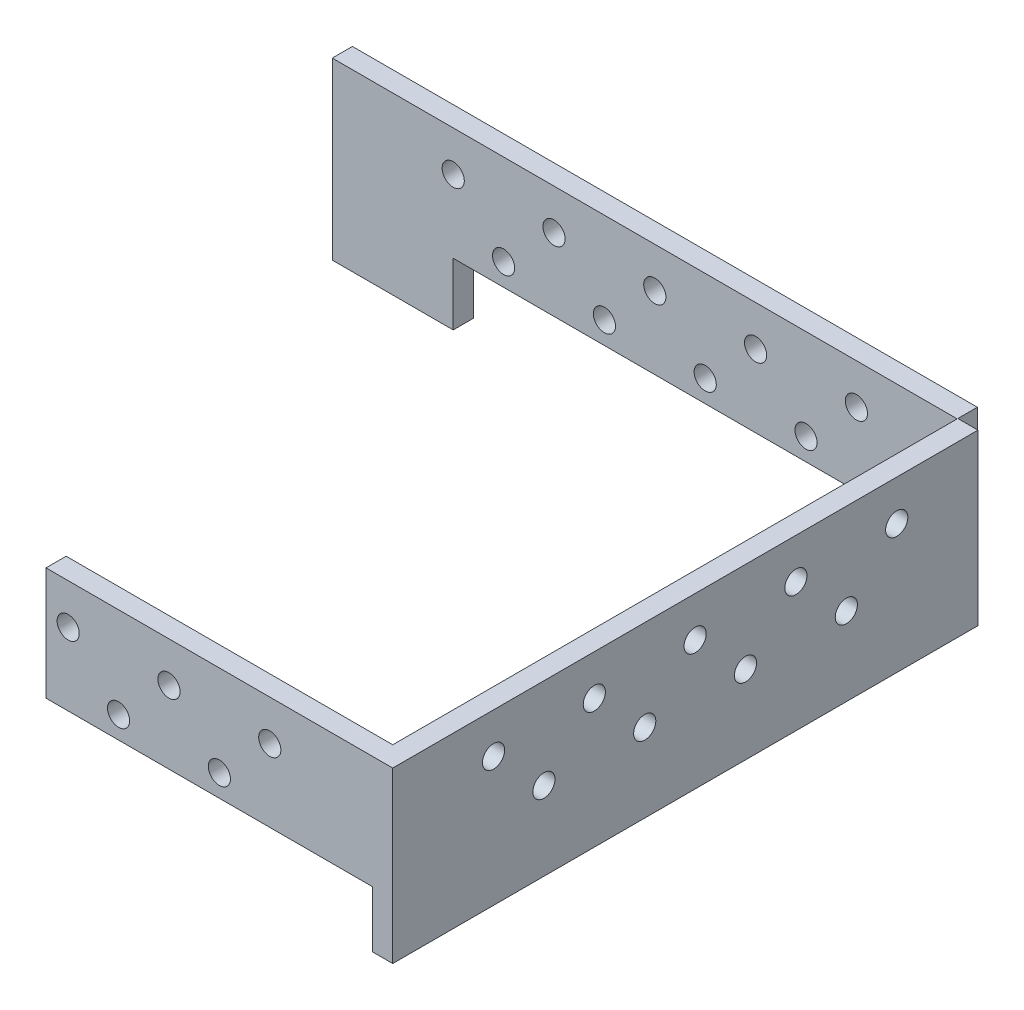
from build123d import *

# Parameters (mm, degrees)
SKETCH1_W                      = 42
SKETCH1_H                      = 145.161285219
BOSS_EXTRUDE1_DEPTH            = 5
BOSS_EXTRUDE2_DEPTH            = 5
SKETCH3_W                      = 5
SKETCH3_H                      = 27.999999523
BOSS_EXTRUDE3_DEPTH            = 81.000003815
F_5_5_5_5_DIAMETER_HOLE1_D     = 5.5
F_5_5_5_5_DIAMETER_HOLE2_D     = 5.5
F_5_5_5_5_DIAMETER_HOLE2_DEPTH = 5
F_5_5_5_5_DIAMETER_HOLE3_D     = 5.5
F_5_5_5_5_DIAMETER_HOLE3_DEPTH = 5


with BuildPart() as part:
    # Sketch1 → Boss-Extrude1 (new body)
    with BuildSketch(Plane(origin=(-5, 0, 0), x_dir=(0, -1, 0), z_dir=(-1, 0, 0))):
        with Locations((21, -72.58064261)):
            Rectangle(SKETCH1_W, SKETCH1_H)
    extrude(amount=-BOSS_EXTRUDE1_DEPTH)

    # Sketch2 → Boss-Extrude2 (add)
    with BuildSketch(Plane(origin=(0, 0, -150), x_dir=(-1, 0, 0), z_dir=(0, 0, -1))):
        Polygon((130, -43.400001526), (160, -43.400001526), (160, 0), (5, 0), (5, -27.999999523), (130, -27.999999523), align=None)
    extrude(amount=-BOSS_EXTRUDE2_DEPTH)

    # Sketch3 → Boss-Extrude3 (add)
    with BuildSketch(Plane.ZY.offset(5)):
        with Locations((-2.5, -13.999999762)):
            Rectangle(SKETCH3_W, SKETCH3_H)
    extrude(amount=BOSS_EXTRUDE3_DEPTH)

    # Ø5.5 (5.5) Diameter Hole1 (through all)
    with Locations(Plane.ZY.offset(5)):
        with Locations((-37.500000596, -22.500000199), (-25.000000199, -9.99999995), (-50.000000795, -9.99999995), (-62.500000795, -22.500000199), (-75.000000795, -9.99999995), (-87.500000795, -22.500000199), (-112.500000795, -22.500000199), (-100.000000795, -9.99999995), (-125.000000795, -9.99999995)):
            Hole(F_5_5_5_5_DIAMETER_HOLE1_D / 2)

    # Ø5.5 (5.5) Diameter Hole2
    with Locations(Plane.XY.offset(-145)):
        with Locations((-30.000000199, -9.99999995), (-42.500000397, -22.500000199), (-67.500000795, -22.500000199), (-55.000000795, -9.99999995), (-80.000001192, -9.99999995), (-92.500000795, -22.500000199), (-117.500000795, -22.500000199), (-105.000000795, -9.99999995), (-130.000003179, -9.99999995)):
            Hole(F_5_5_5_5_DIAMETER_HOLE2_D / 2, depth=F_5_5_5_5_DIAMETER_HOLE2_DEPTH)

    # Ø5.5 (5.5) Diameter Hole3
    with Locations(Plane(origin=(0, 0, -5), x_dir=(-1, 0, 0), z_dir=(0, 0, -1))):
        with Locations((80.50000151, -9.99999995), (68.000001113, -22.500000199), (43.000001113, -22.500000199), (55.500001113, -9.99999995), (30.500000119, -9.99999995)):
            Hole(F_5_5_5_5_DIAMETER_HOLE3_D / 2, depth=F_5_5_5_5_DIAMETER_HOLE3_DEPTH)


solid = part.part
